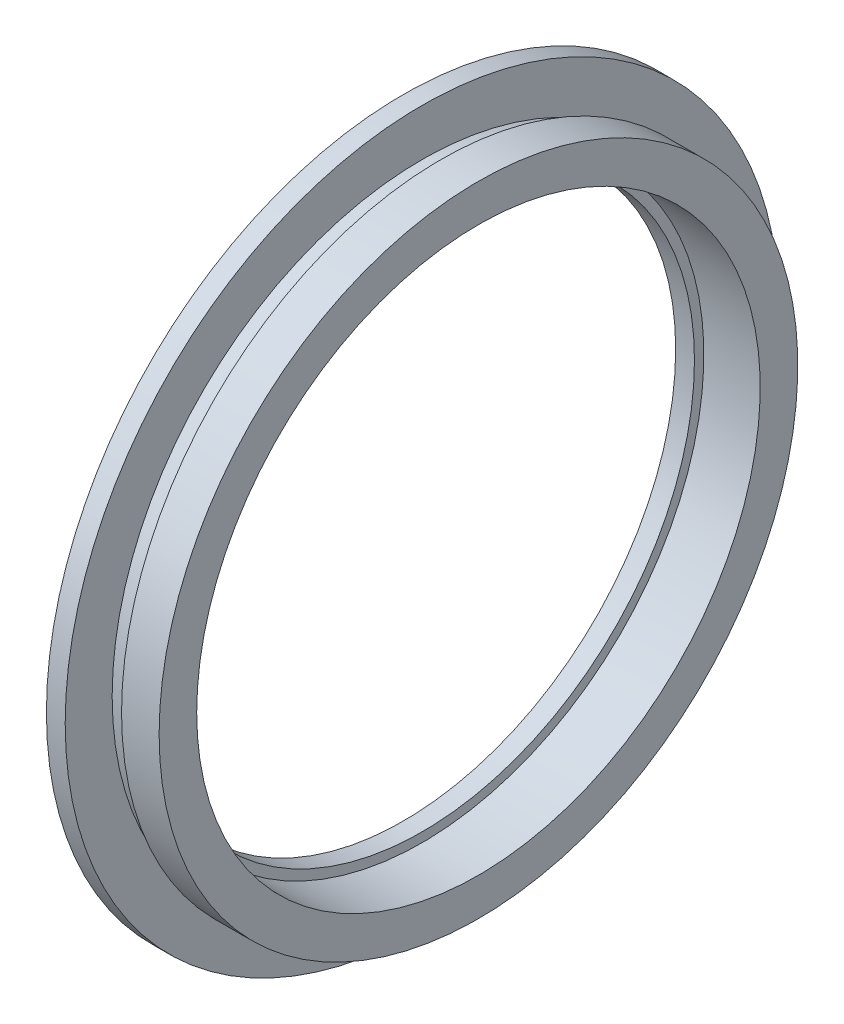
from build123d import *


with BuildPart() as part:
    # Sketch1 → Revolve1 (revolve)
    with BuildSketch(Plane.XY, mode=Mode.PRIVATE) as revolve1_sk:
        Polygon((0, 19), (1, 19), (1, 16.5), (2, 16.5), (2, 17), (4, 17), (4, 15), (1, 15), (1, 14.5), (0, 14.5), align=None)
    revolve(revolve1_sk.sketch.rotate(Axis((0, 0, 0), (1, 0, 0)), 90), axis=Axis((0, 0, 0), (1, 0, 0)))


solid = part.part
